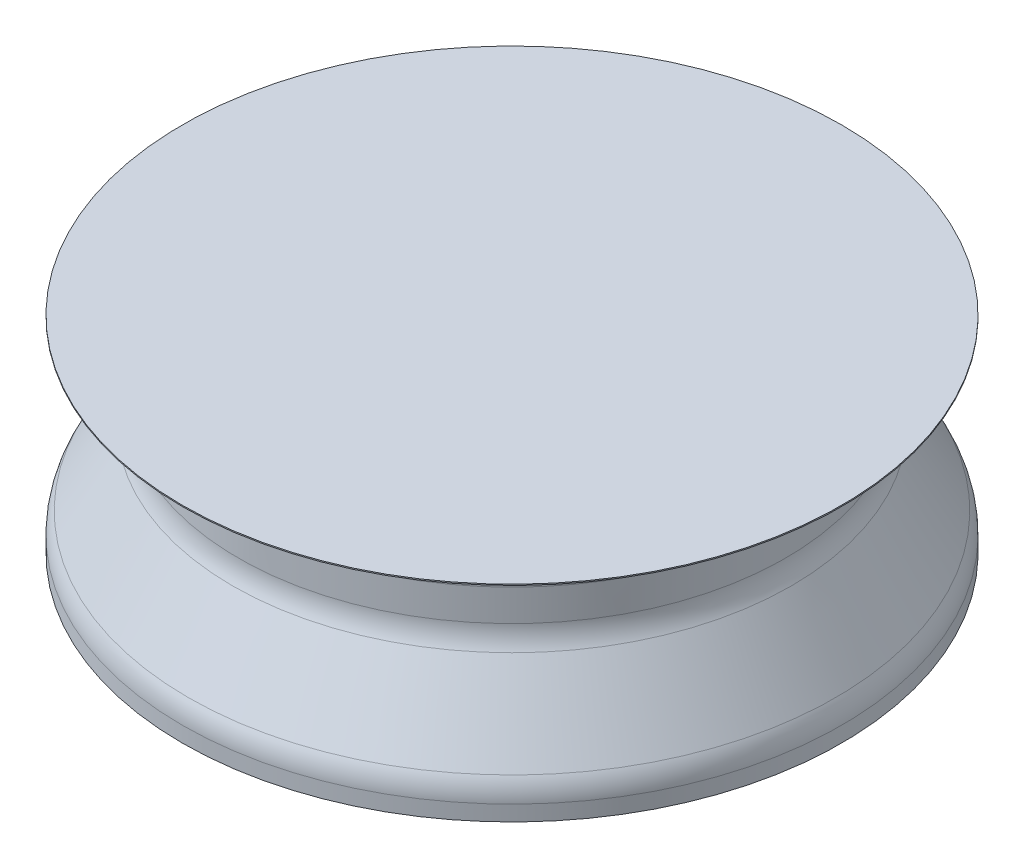
from build123d import *

# Parameters (mm, degrees)
SKETCH12_R          = 80
BOSS_EXTRUDE1_DEPTH = 50
SKETCH13_R          = 25
CUT_EXTRUDE2_DEPTH  = 30
FILLET1_R           = 10
FILLET3_R           = 10
FILLET4_R           = 10


with BuildPart() as part:
    # Sketch12 → Boss-Extrude1 (new body)
    with BuildSketch(Plane(origin=(0, 0, 0), x_dir=(1, 0, 0), z_dir=(0, 1, 0))):
        with Locations(Location((80, 0, 0), (0, 0, 270))):
            Circle(SKETCH12_R)
    extrude(amount=BOSS_EXTRUDE1_DEPTH)

    # Sketch13 → Cut-Extrude2 (cut)
    with BuildSketch(Plane.XZ):
        with Locations(Location((80, 0, 0), (0, 0, 270))):
            Circle(SKETCH13_R)
    extrude(amount=-CUT_EXTRUDE2_DEPTH, mode=Mode.SUBTRACT)

    # Sketch14 → Cut-Revolve1 (revolve, cut)
    with BuildSketch(Plane.XY, mode=Mode.PRIVATE) as cut_revolve1_sk:
        Polygon((-7.132081461, 6.511492019), (0, 6.511492019), (13.618566057, 29.316874818), (13.618566057, 49.723955856), (-7.132081461, 49.723955856), align=None)
    revolve(cut_revolve1_sk.sketch.rotate(Axis((80, 0, 0), (0, 1, 0)), 270), axis=Axis((80, 0, 0), (0, 1, 0)), mode=Mode.SUBTRACT)

    # Fillet1
    fillet1_edges = [part.edges().sort_by_distance(p)[0] for p in [
        (80, 49.723955856, 66.381433943),
    ]]
    fillet(fillet1_edges, radius=FILLET1_R)

    # Fillet3
    fillet3_edges = [part.edges().sort_by_distance(p)[0] for p in [
        (160, 6.511492019, 0),
    ]]
    fillet(fillet3_edges, radius=FILLET3_R)

    # Fillet4
    fillet4_edges = [part.edges().sort_by_distance(p)[0] for p in [
        (80, 29.316874818, 66.381433943),
    ]]
    fillet(fillet4_edges, radius=FILLET4_R)


solid = part.part
